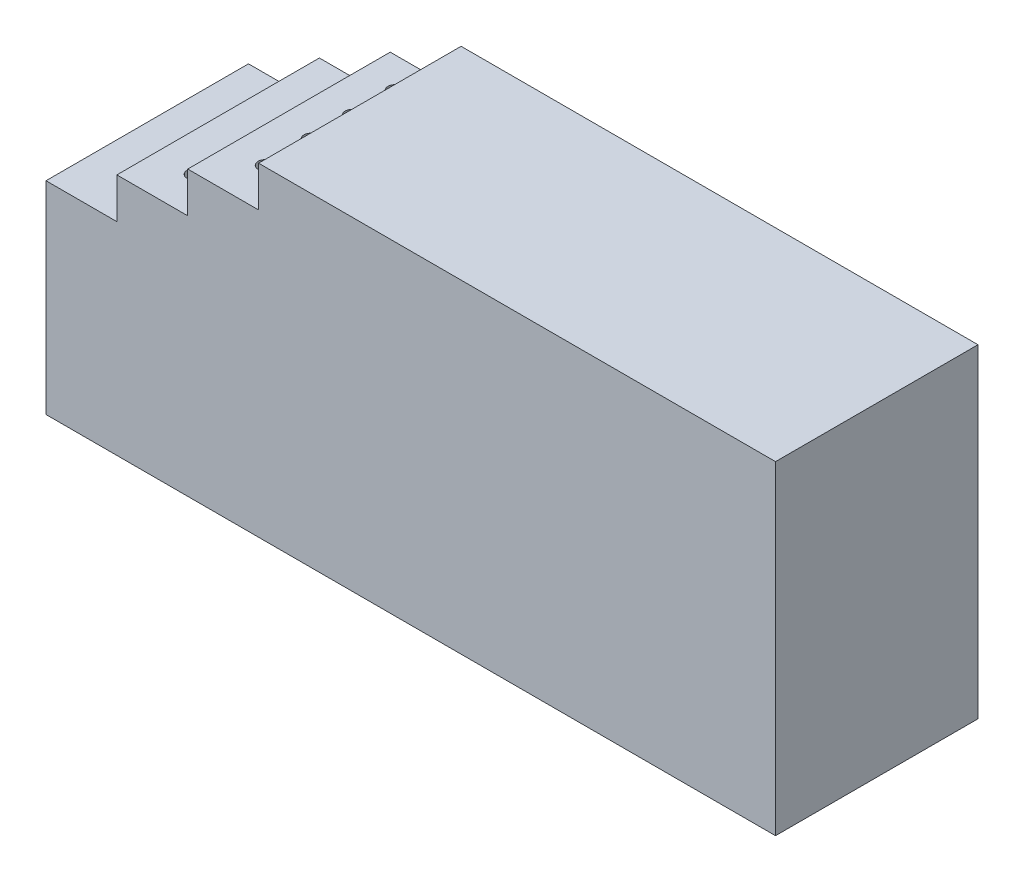
from build123d import *

# Parameters (mm, degrees)
SKETCH_1_W          = 35
SKETCH_1_H          = 100
EXTRUDE_1_DEPTH     = 100
SKETCH_1_3_W        = 35
SKETCH_1_3_H        = 100
EXTRUDE_2_DEPTH     = 120
SKETCH_1_4_W        = 35
SKETCH_1_4_H        = 100
EXTRUDE_3_DEPTH     = 140
SKETCH_1_5_W        = 195.279005499
SKETCH_1_5_H        = 100
EXTRUDE_4_DEPTH     = 160
SKETCH_1_6_W        = 60
SKETCH_1_6_H        = 100
EXTRUDE_5_DEPTH     = 160
SKETCH_17_R         = 3.5
CUT_EXTRUDE_4_DEPTH = 25
SKETCH_18_R         = 3.5
CUT_EXTRUDE_5_DEPTH = 25


with BuildPart() as part:
    # Эскиз1 → Бобышка-Вытянуть1 (new body)
    with BuildSketch(Plane(origin=(0, 0, 0), x_dir=(1, 0, 0), z_dir=(0, 1, 0))):
        with Locations((17.5, 50)):
            Rectangle(SKETCH_1_W, SKETCH_1_H)
    extrude(amount=EXTRUDE_1_DEPTH)

    # Эскиз1<3> → Бобышка-Вытянуть2 (add)
    with BuildSketch(Plane(origin=(0, 0, 0), x_dir=(1, 0, 0), z_dir=(0, 1, 0))):
        with Locations((52.5, 50)):
            Rectangle(SKETCH_1_3_W, SKETCH_1_3_H)
    extrude(amount=EXTRUDE_2_DEPTH)

    # Эскиз1<4> → Бобышка-Вытянуть3 (add)
    with BuildSketch(Plane(origin=(0, 0, 0), x_dir=(1, 0, 0), z_dir=(0, 1, 0))):
        with Locations((87.5, 50)):
            Rectangle(SKETCH_1_4_W, SKETCH_1_4_H)
    extrude(amount=EXTRUDE_3_DEPTH)

    # Эскиз1<5> → Бобышка-Вытянуть4 (add)
    with BuildSketch(Plane(origin=(0, 0, 0), x_dir=(1, 0, 0), z_dir=(0, 1, 0))):
        with Locations((202.639502749, 50)):
            Rectangle(SKETCH_1_5_W, SKETCH_1_5_H)
    extrude(amount=EXTRUDE_4_DEPTH)

    # Эскиз1<6> → Бобышка-Вытянуть5 (add)
    with BuildSketch(Plane(origin=(0, 0, 0), x_dir=(1, 0, 0), z_dir=(0, 1, 0))):
        with Locations((330.279005499, 50)):
            Rectangle(SKETCH_1_6_W, SKETCH_1_6_H)
    extrude(amount=EXTRUDE_5_DEPTH)

    # Эскиз17 → Вырез-Вытянуть4 (cut)
    with BuildSketch(Plane(origin=(0, 120, 0), x_dir=(1, 0, 0), z_dir=(0, 1, 0))):
        with Locations((53.859111314, 83.458390634)):
            Circle(SKETCH_17_R)
        with Locations((53.859111314, 62.301745528)):
            Circle(SKETCH_17_R)
        with Locations((53.859111314, 41.942908687)):
            Circle(SKETCH_17_R)
        with Locations((53.859111314, 19.312140714)):
            Circle(SKETCH_17_R)
    extrude(amount=-CUT_EXTRUDE_4_DEPTH, mode=Mode.SUBTRACT)

    # Эскиз18 → Вырез-Вытянуть5 (cut)
    with BuildSketch(Plane(origin=(0, 140, 0), x_dir=(1, 0, 0), z_dir=(0, 1, 0))):
        with Locations((87.572175359, 84.853566518)):
            Circle(SKETCH_18_R)
        with Locations((87.572175359, 63.696921411)):
            Circle(SKETCH_18_R)
        with Locations((87.572175359, 43.338084571)):
            Circle(SKETCH_18_R)
        with Locations((87.572175359, 20.707316598)):
            Circle(SKETCH_18_R)
    extrude(amount=-CUT_EXTRUDE_5_DEPTH, mode=Mode.SUBTRACT)


solid = part.part
